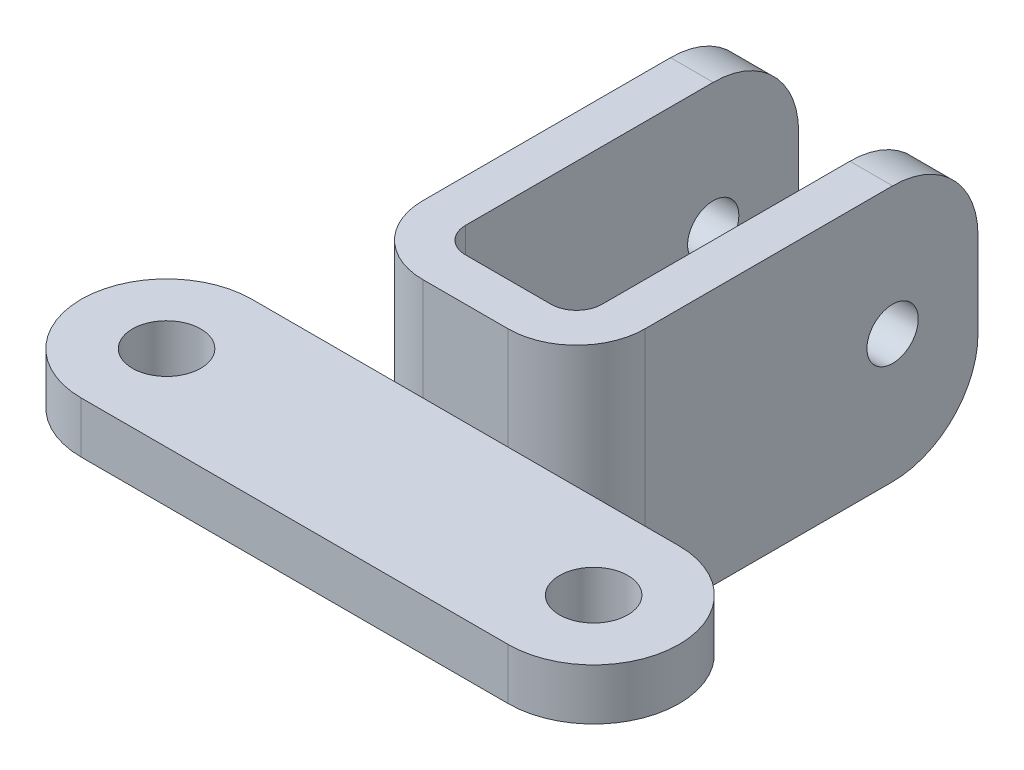
from build123d import *

# Parameters (mm, degrees)
EXTRUDE_THIN1_DEPTH     = 15
FILLET1_R               = 10
SKETCH2_R               = 4
BOSS_EXTRUDE1_DEPTH     = 3
CUT_EXTRUDE1_DEPTH      = 69.833131557
CUT_EXTRUDE1_DEPTH_BACK = 69.833131557


with BuildPart() as part:
    # Sketch1 → Extrude-Thin1 (new, symmetric)
    with BuildSketch(Plane(origin=(0, 0, 0), x_dir=(1, 0, 0), z_dir=(0, 1, 0))):
        with BuildLine():
            Line((-13, 47), (-13, 8))
            ThreePointArc((-13, 8), (-10.656854249, 2.343145751), (-5, 0))
            Line((-5, 0), (0, 0))
            Line((0, 0), (5, 0))
            ThreePointArc((5, 0), (10.656854249, 2.343145751), (13, 8))
            Line((13, 8), (13, 47))
            Line((13, 47), (8, 47))
            Line((8, 47), (8, 8))
            ThreePointArc((8, 8), (7.121320344, 5.878679656), (5, 5))
            Line((5, 5), (0, 5))
            Line((0, 5), (-5, 5))
            ThreePointArc((-5, 5), (-7.121320344, 5.878679656), (-8, 8))
            Line((-8, 8), (-8, 47))
            Line((-8, 47), (-13, 47))
        make_face()
    extrude(amount=EXTRUDE_THIN1_DEPTH, both=True)

    # Fillet1
    fillet1_edges = [part.edges().sort_by_distance(p)[0] for p in [
        (-10.5, -15, -47),
        (10.5, -15, -47),
        (-10.5, 15, -47),
        (10.5, 15, -47),
    ]]
    fillet(fillet1_edges, radius=FILLET1_R)

    # Sketch2 → Boss-Extrude1 (add, symmetric)
    with BuildSketch(Plane(origin=(0, 0, 0), x_dir=(1, 0, 0), z_dir=(0, 1, 0))):
        with BuildLine():
            Line((5, 0), (-5, 0))
            Line((-5, 0), (-25, 0))
            ThreePointArc((-25, 0), (-35, -10), (-25, -20))
            Line((-25, -20), (25, -20))
            ThreePointArc((25, -20), (35, -10), (25, 0))
            Line((25, 0), (5, 0))
        make_face()
        with Locations(Location((-25, -10, 0), (0, 0, 270))):
            Circle(SKETCH2_R, mode=Mode.SUBTRACT)
        with Locations(Location((25, -10, 0), (0, 0, 270))):
            Circle(SKETCH2_R, mode=Mode.SUBTRACT)
    extrude(amount=BOSS_EXTRUDE1_DEPTH, both=True)

    # Sketch3 → Cut-Extrude1 (cut, two sides: drawn at the far end of the back side and taken through both)
    with BuildSketch(Plane(origin=(13, 0, 0), x_dir=(0, 0, -1), z_dir=(1, 0, 0)).offset(-CUT_EXTRUDE1_DEPTH_BACK)):
        with BuildLine():
            ThreePointArc((40, 0), (37, 3), (34, 0))
            Line((34, 0), (40, 0))
        make_face()
        with BuildLine():
            Line((40, 0), (34, 0))
            ThreePointArc((34, 0), (37, -3), (40, 0))
        make_face()
    extrude(amount=CUT_EXTRUDE1_DEPTH + CUT_EXTRUDE1_DEPTH_BACK, mode=Mode.SUBTRACT)


solid = part.part
